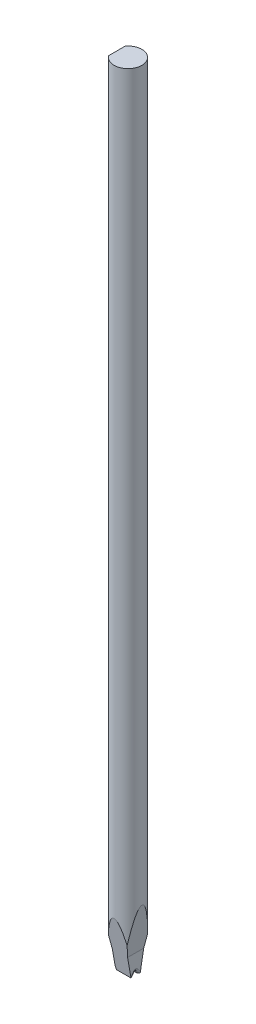
from build123d import *

# Parameters (mm, degrees)
SKETCH_TL_CUTTING_R    = 1.4986
TL_CUTTING_DEPTH       = 85.4964
SKETCH_TDF_CUTTING_W   = 3.01719996
SKETCH_TDF_CUTTING_H   = 3.01719996
TDF_CUTTING_DEPTH      = 86.522663762
VW_VR_GRINDING_DEPTH   = 1.50859998
VW_VR_GRINDING_2_DEPTH = 1.50859998
ISA_GRINDING_DEPTH     = 1.50859998
SKETCH_PRE_FRX_BRX_W   = 0.66310002
SKETCH_PRE_FRX_BRX_H   = 2.1082
SKETCH_PRE_FRX_BRX_W_2 = 0.69309996
PRE_FRX_BRX_DEPTH      = 1.50859998
FA_BA_GRINDING_DEPTH   = 1.50859998
BR_EDM_R               = 0.50038
FR_EDM_R               = 0.24892


with BuildPart() as part:
    # sketch_TL_cutting → TL_cutting (new body)
    with BuildSketch(Plane(origin=(0, 0, 0), x_dir=(1, 0, 0), z_dir=(0, 1, 0))):
        with Locations(Location((0, 0, 0), (0, 0, 90))):
            Circle(SKETCH_TL_CUTTING_R)
    extrude(amount=TL_CUTTING_DEPTH)

    # sketch_TDF_cutting → TDF_cutting (cut, through all)
    with BuildSketch(Plane(origin=(0, 0, 0), x_dir=(1, 0, 0), z_dir=(0, 1, 0))):
        with Locations((-2.71001998, 0)):
            Rectangle(SKETCH_TDF_CUTTING_W, SKETCH_TDF_CUTTING_H)
    extrude(amount=TDF_CUTTING_DEPTH, mode=Mode.SUBTRACT)


with BuildPart() as body_2:
    # sketch_VW_VR_grinding → VW_VR_grinding (new, symmetric)
    with BuildSketch(Plane(origin=(0, 0, 0), x_dir=(0, 0, -1), z_dir=(1, 0, 0))):
        with BuildLine():
            Line((-1.49360001, -0.00999998), (-1.49360001, 2.097088914))
            ThreePointArc((-1.49360001, 2.097088914), (-1.493648337, 2.098195792), (-1.493792952, 2.099294246))
            Line((-1.493792952, 2.099294246), (-1.51859996, 2.239981782))
            Line((-1.51859996, 2.239981782), (-1.50859998, -0.00999998))
            Line((-1.50859998, -0.00999998), (-1.49360001, -0.00999998))
        make_face()
    extrude(amount=VW_VR_GRINDING_DEPTH, both=True)


with BuildPart() as body_3:
    # sketch_VW_VR_grinding → VW_VR_grinding 2 (new, symmetric)
    with BuildSketch(Plane(origin=(0, 0, 0), x_dir=(0, 0, -1), z_dir=(1, 0, 0))):
        with BuildLine():
            Line((1.49360001, -0.00999998), (1.49360001, 2.097088914))
            ThreePointArc((1.49360001, 2.097088914), (1.493648337, 2.098195792), (1.493792952, 2.099294246))
            Line((1.493792952, 2.099294246), (1.51859996, 2.239981782))
            Line((1.51859996, 2.239981782), (1.50859998, -0.00999998))
            Line((1.50859998, -0.00999998), (1.49360001, -0.00999998))
        make_face()
    extrude(amount=VW_VR_GRINDING_2_DEPTH, both=True)


    add(body_2.part)  # ISA_grinding merges body 2
    # sketch_ISA_grinding → ISA_grinding (add, symmetric)
    with BuildSketch(Plane(origin=(0, 0, 0), x_dir=(0, 0, -1), z_dir=(1, 0, 0))):
        Polygon((-0.50038, 0), (0.50038, 0), (1.50859998, 5.717899643), (1.50859998, -0.02999994), (-1.50859998, -0.02999994), (-1.50859998, 5.717899643), align=None)
    extrude(amount=ISA_GRINDING_DEPTH, both=True)

    # sketch_pre_FRX_BRX → pre_FRX_BRX (add, symmetric)
    with BuildSketch(Plane.XY):
        with Locations((1.16704999, 1.04410002)):
            Rectangle(SKETCH_PRE_FRX_BRX_W, SKETCH_PRE_FRX_BRX_H)
        with Locations((-1.17204998, 1.04410002)):
            Rectangle(SKETCH_PRE_FRX_BRX_W_2, SKETCH_PRE_FRX_BRX_H)
    extrude(amount=PRE_FRX_BRX_DEPTH, both=True)

    # sketch_FA_BA_grinding → FA_BA_grinding (add, symmetric)
    with BuildSketch(Plane.XY):
        Polygon((0.8255, -0.00999998), (0.8255, 2.1082), (1.6256, 7.801207315), (1.6256, -0.00999998), align=None)
        Polygon((-0.8255, -0.00999998), (-0.8255, 2.1082), (-1.32842, 5.686661741), (-1.32842, -0.00999998), align=None)
    extrude(amount=FA_BA_GRINDING_DEPTH, both=True)


with BuildPart() as part_1:
    add(part.part)

    # B1_fix: cut body 3
    add(body_3.part, mode=Mode.SUBTRACT)

    # V-Groove_EDM: sweep along a path in sketch_contour_V-Groove
    with BuildLine(Plane.XY) as v_groove_edm_path:
        Line((-1.20142, 0.3556), (1.4986, 0.3556))
    # sketch_section_V-Groove → V-Groove_EDM (sweep, cut)
    with BuildSketch(Plane(origin=(-1.20142, 0, -1.2954), x_dir=(0, 0, -1), z_dir=(1, 0, 0))):
        with BuildLine():
            Line((-1.253787076, 0.333937683), (-1.012959332, -0.00999998))
            Line((-1.012959332, -0.00999998), (-1.577840668, -0.00999998))
            Line((-1.577840668, -0.00999998), (-1.337012924, 0.333937683))
            ThreePointArc((-1.337012924, 0.333937683), (-1.2954, 0.3556), (-1.253787076, 0.333937683))
        make_face()
    sweep(path=v_groove_edm_path.line, mode=Mode.SUBTRACT)

    # BR_EDM
    br_edm_edges = [part_1.edges().sort_by_distance(p)[0] for p in [
        (-0.8255, 0.3556, 0),
        (-0.8255, 0.166968841, -0.158525765),
        (-0.8255, 0.166968841, 0.158525765),
    ]]
    fillet(br_edm_edges, radius=BR_EDM_R)

    # FR_EDM
    fr_edm_edges = [part_1.edges().sort_by_distance(p)[0] for p in [
        (0.8255, 0.166968841, -0.158525765),
        (0.8255, 0.166968841, 0.158525765),
        (0.8255, 0.3556, 0),
    ]]
    fillet(fr_edm_edges, radius=FR_EDM_R)


solid = part_1.part
